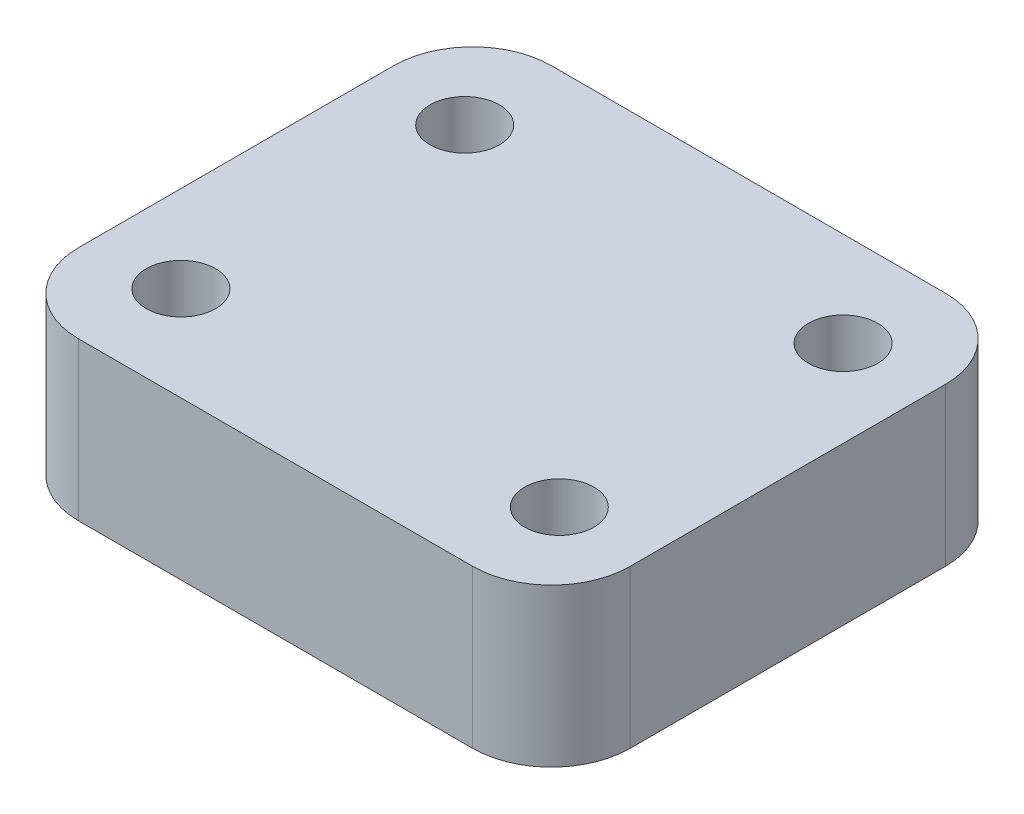
from build123d import *

# Parameters (mm, degrees)
SKETCH1_W           = 35
SKETCH1_H           = 30
BOSS_EXTRUDE1_DEPTH = 10
SKETCH2_R           = 2.2
CUT_EXTRUDE1_DEPTH  = 26.124689053
FILLET1_R           = 5


with BuildPart() as part:
    # Sketch1 → Boss-Extrude1 (new body)
    with BuildSketch(Plane(origin=(0, 0, 0), x_dir=(1, 0, 0), z_dir=(0, 1, 0))):
        Rectangle(SKETCH1_W, SKETCH1_H)
    extrude(amount=BOSS_EXTRUDE1_DEPTH)

    # Sketch2 → Cut-Extrude1 (cut, through all)
    with BuildSketch(Plane(origin=(0, 10, 0), x_dir=(1, 0, 0), z_dir=(0, 1, 0))):
        with Locations(Location((-12, 9, 0), (0, 0, 270))):
            Circle(SKETCH2_R)
        with Locations(Location((12, 9, 0), (0, 0, 270))):
            Circle(SKETCH2_R)
        with Locations(Location((12, -9, 0), (0, 0, 270))):
            Circle(SKETCH2_R)
        with Locations(Location((-12, -9, 0), (0, 0, 270))):
            Circle(SKETCH2_R)
    extrude(amount=-CUT_EXTRUDE1_DEPTH, mode=Mode.SUBTRACT)

    # Fillet1
    fillet1_edges = [part.edges().sort_by_distance(p)[0] for p in [
        (17.5, 5, 15),
        (-17.5, 5, 15),
        (-17.5, 5, -15),
        (17.5, 5, -15),
    ]]
    fillet(fillet1_edges, radius=FILLET1_R)


solid = part.part
